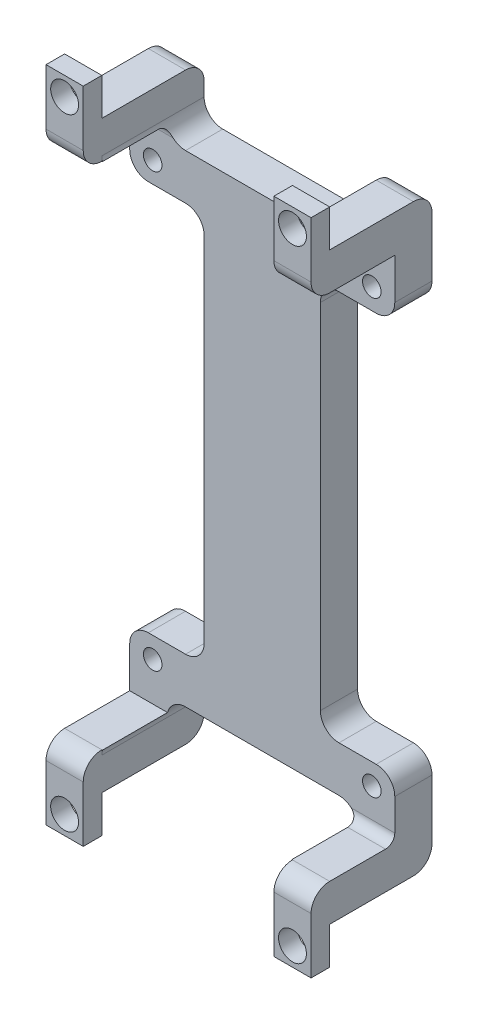
from build123d import *

# Parameters (mm, degrees)
SKETCH3_W           = 28.5
SKETCH3_H           = 51.8
BOSS_EXTRUDE4_DEPTH = 4
SKETCH7_W           = 4
SKETCH7_H           = 4
BOSS_EXTRUDE5_DEPTH = 5.5
SKETCH8_W           = 4
SKETCH8_H           = 4
BOSS_EXTRUDE6_DEPTH = 7
SKETCH10_R          = 1
CUT_EXTRUDE2_DEPTH  = 4
SKETCH11_W          = 8
SKETCH11_H          = 42
CUT_EXTRUDE3_DEPTH  = 36.185543907
FILLET2_R           = 1
FILLET3_R           = 2
SKETCH9_W           = 4
SKETCH9_H           = 8
SKETCH9_R           = 1.5
BOSS_EXTRUDE8_DEPTH = 2
FILLET4_R           = 2


with BuildPart() as part:
    # Sketch3 → Boss-Extrude4 (new body)
    with BuildSketch(Plane(origin=(0, 0, 0), x_dir=(-1, 0, 0), z_dir=(0, 0, 1))):
        Rectangle(SKETCH3_W, SKETCH3_H)
    extrude(amount=BOSS_EXTRUDE4_DEPTH)

    # Sketch7 → Boss-Extrude5 (add)
    with BuildSketch(Plane(origin=(0, 25.9, 0), x_dir=(1, 0, 0), z_dir=(0, 1, 0))):
        with Locations((-12.25, -2)):
            Rectangle(SKETCH7_W, SKETCH7_H)
        with Locations((12.25, -2)):
            Rectangle(SKETCH7_W, SKETCH7_H)
    boss_extrude5 = extrude(amount=BOSS_EXTRUDE5_DEPTH)

    # Mirror1: Boss-Extrude5 across plane
    add(boss_extrude5.mirror(Plane.ZX))

    # Sketch8 → Boss-Extrude6 (add)
    with BuildSketch(Plane.XY.offset(4)):
        with Locations((-12.25, 29.4)):
            Rectangle(SKETCH8_W, SKETCH8_H)
        with Locations((12.25, 29.4)):
            Rectangle(SKETCH8_W, SKETCH8_H)
        with Locations((12.25, -29.4)):
            Rectangle(SKETCH8_W, SKETCH8_H)
        with Locations((-12.25, -29.4)):
            Rectangle(SKETCH8_W, SKETCH8_H)
    extrude(amount=BOSS_EXTRUDE6_DEPTH)

    # Sketch10 → Cut-Extrude2 (cut)
    with BuildSketch(Plane.XY.offset(4)):
        with Locations((-11.78, 23.25)):
            Circle(SKETCH10_R)
        with Locations(Location((-11.78, -23.25, 0), (0, 0, 180))):
            Circle(SKETCH10_R)
        with Locations((11.78, -23.25)):
            Circle(SKETCH10_R)
        with Locations(Location((11.78, 23.25, 0), (0, 0, 180))):
            Circle(SKETCH10_R)
    extrude(amount=-CUT_EXTRUDE2_DEPTH, mode=Mode.SUBTRACT)

    # Sketch11 → Cut-Extrude3 (cut, through all)
    with BuildSketch(Plane.XY.offset(4)):
        with Locations((-10.25, 0)):
            Rectangle(SKETCH11_W, SKETCH11_H)
        with Locations((10.25, 0)):
            Rectangle(SKETCH11_W, SKETCH11_H)
    extrude(amount=-CUT_EXTRUDE3_DEPTH, mode=Mode.SUBTRACT)

    # Fillet2
    fillet2_edges = [part.edges().sort_by_distance(p)[0] for p in [
        (12.25, -27.4, 4),
        (-12.25, 27.4, 4),
    ]]
    fillet(fillet2_edges, radius=FILLET2_R)

    # Fillet3
    fillet3_edges = [part.edges().sort_by_distance(p)[0] for p in [
        (-10.25, -25.9, 2),
        (10.25, -25.9, 2),
        (-10.25, 25.9, 2),
        (10.25, 25.9, 2),
    ]]
    fillet(fillet3_edges, radius=FILLET3_R)

    # Sketch9 → Boss-Extrude8 (add)
    # profile 1 of 4: a face of its own
    with BuildSketch(Plane.XY.offset(11)):
        with Locations((-12.25, 31.4)):
            Rectangle(SKETCH9_W, SKETCH9_H)
        with Locations((-12.25, 33.4)):
            Circle(SKETCH9_R, mode=Mode.SUBTRACT)
    # profile 2 of 4: a face of its own
    with BuildSketch(Plane.XY.offset(11)):
        with Locations((12.25, 31.4)):
            Rectangle(SKETCH9_W, SKETCH9_H)
        with Locations(Location((12.25, 33.4, 0), (0, 0, 180))):
            Circle(SKETCH9_R, mode=Mode.SUBTRACT)
    # profile 3 of 4: a face of its own
    with BuildSketch(Plane.XY.offset(11)):
        with Locations((12.25, -31.4)):
            Rectangle(SKETCH9_W, SKETCH9_H)
        with Locations((12.25, -33.4)):
            Circle(SKETCH9_R, mode=Mode.SUBTRACT)
    # profile 4 of 4: a face of its own
    with BuildSketch(Plane.XY.offset(11)):
        with Locations((-12.25, -31.4)):
            Rectangle(SKETCH9_W, SKETCH9_H)
        with Locations(Location((-12.25, -33.4, 0), (0, 0, 180))):
            Circle(SKETCH9_R, mode=Mode.SUBTRACT)
    extrude(amount=BOSS_EXTRUDE8_DEPTH)

    # Fillet4
    fillet4_edges = [part.edges().sort_by_distance(p)[0] for p in [
        (-14.25, -21, 2),
        (-14.25, 21, 2),
        (-6.25, 21, 2),
        (-6.25, -21, 2),
        (6.25, 21, 2),
        (14.25, 21, 2),
        (14.25, -21, 2),
        (6.25, -21, 2),
        (-12.25, 31.4, 0),
        (-12.25, -27.4, 13),
        (12.25, 31.4, 0),
        (12.25, -27.4, 13),
        (12.25, 27.4, 13),
        (-12.25, 27.4, 13),
        (-12.25, -31.4, 0),
        (12.25, -31.4, 0),
    ]]
    fillet(fillet4_edges, radius=FILLET4_R)


solid = part.part
